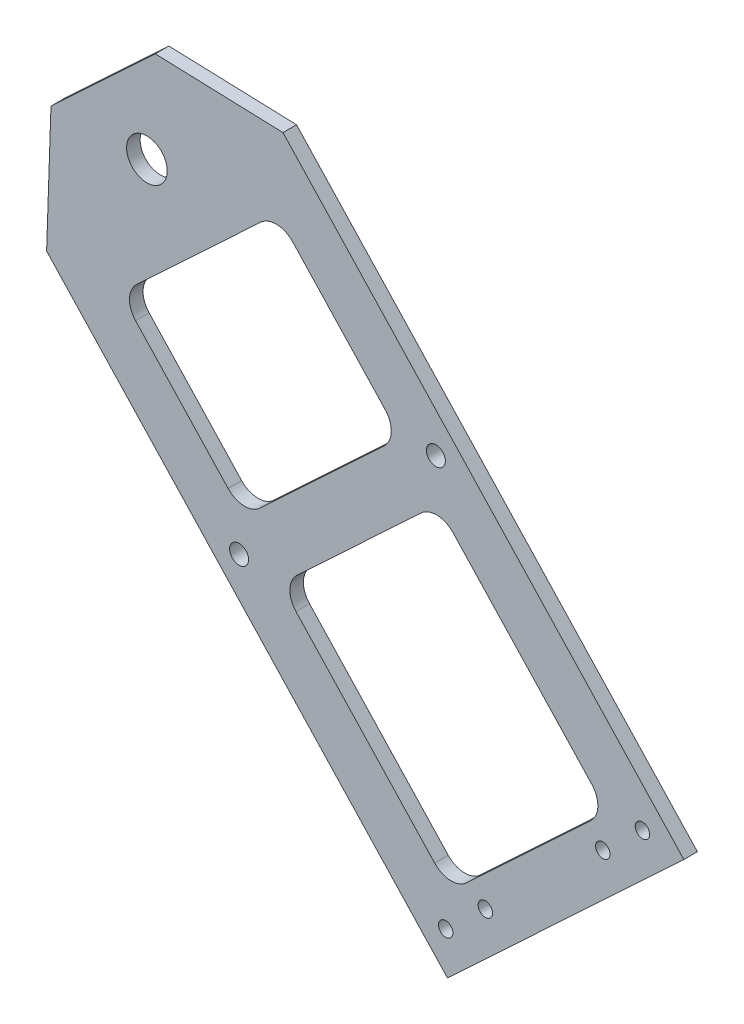
from build123d import *

# Parameters (mm, degrees)
SKETCH_1_R      = 2.1
SKETCH_1_R_2    = 4.5
SKETCH_1_R_3    = 1.6
EXTRUDE_1_DEPTH = 3


with BuildPart() as part:
    # 草图1 → 凸台-拉伸1 (new body)
    with BuildSketch(Plane.XY):
        Polygon((-324.62596071, -164.077614251), (-272.3024403, -115.202168351), (-361.042775034, -20.201363137), (-389.310642718, -19.238213832), (-412.403146139, -40.808941352), (-413.366295444, -69.076809037), align=None)
        with Locations((-327.200821851, -65.220494679)):
            Circle(SKETCH_1_R, mode=Mode.SUBTRACT)
        with Locations((-370.755037164, -105.904525064)):
            Circle(SKETCH_1_R, mode=Mode.SUBTRACT)
        with Locations((-391.163719404, -40.400588623)):
            Circle(SKETCH_1_R_2, mode=Mode.SUBTRACT)
        with Locations((-325.019633878, -154.866478521)):
            Circle(SKETCH_1_R_3, mode=Mode.SUBTRACT)
        with Locations((-316.250328782, -146.675063007)):
            Circle(SKETCH_1_R_3, mode=Mode.SUBTRACT)
        with Locations((-290.234723661, -122.373863649)):
            Circle(SKETCH_1_R_3, mode=Mode.SUBTRACT)
        with Locations((-281.465418565, -114.182448135)):
            Circle(SKETCH_1_R_3, mode=Mode.SUBTRACT)
        with BuildLine():
            Line((-320.394194004, -143.703803843), (-292.917038034, -118.037368566))
            ThreePointArc((-292.917038034, -118.037368566), (-291.333027599, -114.553753794), (-292.676250708, -110.970401645))
            Line((-292.676250708, -110.970401645), (-323.394058885, -78.085507532))
            ThreePointArc((-323.394058885, -78.085507532), (-326.877673657, -76.501497097), (-330.461025806, -77.844720206))
            Line((-330.461025806, -77.844720206), (-357.938181776, -103.511155483))
            ThreePointArc((-357.938181776, -103.511155483), (-359.522192211, -106.994770255), (-358.178969102, -110.578122404))
            Line((-358.178969102, -110.578122404), (-327.461160925, -143.463016517))
            ThreePointArc((-327.461160925, -143.463016517), (-323.977546152, -145.047026952), (-320.394194004, -143.703803843))
        make_face(mode=Mode.SUBTRACT)
        with BuildLine():
            Line((-366.12959729, -94.741850386), (-338.65244132, -69.075415109))
            ThreePointArc((-338.65244132, -69.075415109), (-337.068430885, -65.591800337), (-338.411653994, -62.008448188))
            Line((-338.411653994, -62.008448188), (-358.890192778, -40.085185447))
            ThreePointArc((-358.890192778, -40.085185447), (-362.373807551, -38.501175012), (-365.957159699, -39.84439812))
            Line((-365.957159699, -39.84439812), (-393.434315669, -65.510833397))
            ThreePointArc((-393.434315669, -65.510833397), (-395.018326104, -68.99444817), (-393.675102995, -72.577800318))
            Line((-393.675102995, -72.577800318), (-373.196564211, -94.50106306))
            ThreePointArc((-373.196564211, -94.50106306), (-369.712949438, -96.085073495), (-366.12959729, -94.741850386))
        make_face(mode=Mode.SUBTRACT)
    extrude(amount=EXTRUDE_1_DEPTH)


solid = part.part
